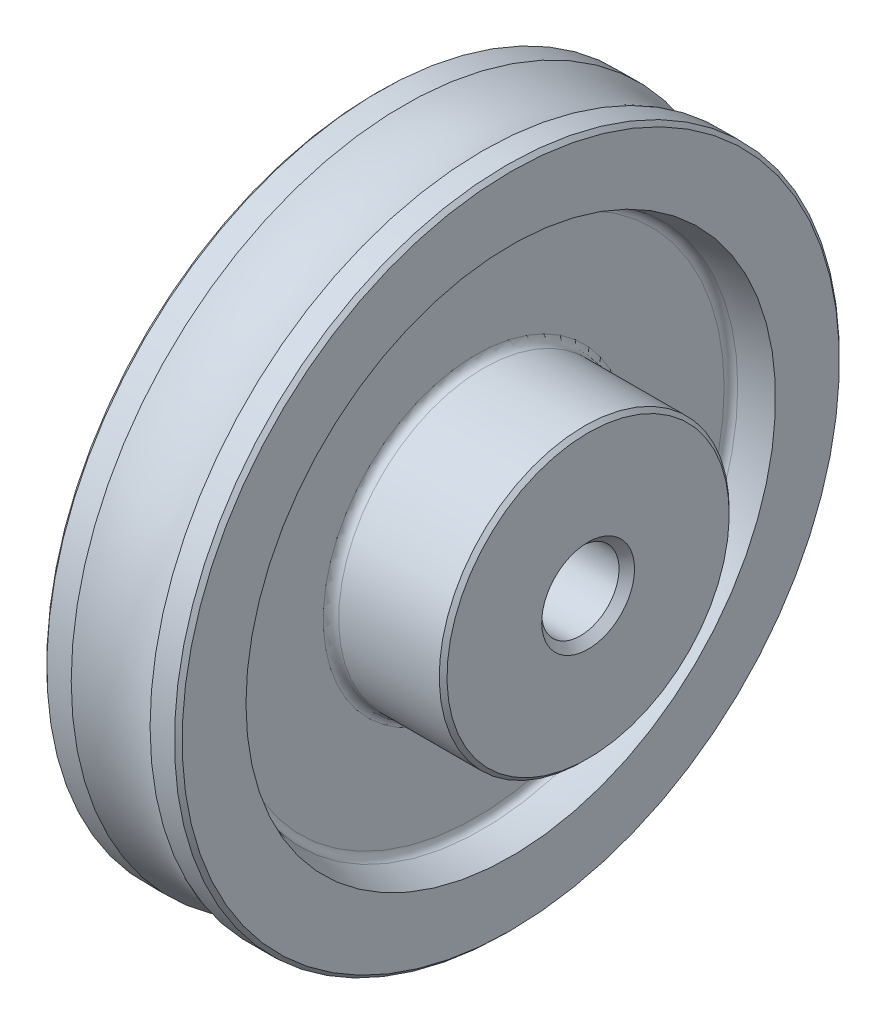
from build123d import *

# Parameters (mm, degrees)
CROQUIS2_R            = 27
CROQUIS4_R            = 10
CORTAR_EXTRUIR1_DEPTH = 134.4803358
CHAFL_N1_SIZE         = 1
CHAFL_N2_SIZE         = 2
REDONDEO3_R           = 2
REDONDEO5_R           = 2


with BuildPart() as part:
    # Croquis1 → Revolución1 (revolve)
    with BuildSketch(Plane.XY):
        Polygon((-17.5, 0), (17.5, 0), (37.5, 0), (37.5, 37.5), (17.5, 37.5), (17.5, 86), (-17.5, 86), align=None)
    revolve(axis=Axis((0, 0, 0), (-1, 0, 0)))

    # Croquis2 → Cortar-Revolución1 (revolve, cut)
    with BuildSketch(Plane.XY):
        with Locations((0, 111)):
            Circle(CROQUIS2_R)
    revolve(axis=Axis((0, 0, 0), (-1, 0, 0)), mode=Mode.SUBTRACT)

    # Croquis3 → Cortar-Revolución2 (revolve, cut)
    with BuildSketch(Plane.XY, mode=Mode.PRIVATE) as cortar_revoluci_n2_sk:
        with BuildLine():
            Line((-8.5, 37.5), (-8.5, 65.830873376))
            ThreePointArc((-8.5, 65.830873376), (-13.06832274, 66.93505996), (-17.5, 68.5))
            Line((-17.5, 68.5), (-17.5, 37.5))
            Line((-17.5, 37.5), (-8.5, 37.5))
        make_face()
        with BuildLine():
            Line((8.5, 37.5), (8.5, 65.830873376))
            ThreePointArc((8.5, 65.830873376), (13.06832274, 66.93505996), (17.5, 68.5))
            Line((17.5, 68.5), (17.5, 37.5))
            Line((17.5, 37.5), (8.5, 37.5))
        make_face()
    revolve(cortar_revoluci_n2_sk.sketch.rotate(Axis((0, 0, 0), (1, 0, 0)), 90), axis=Axis((0, 0, 0), (1, 0, 0)), mode=Mode.SUBTRACT)

    # Croquis4 → Cortar-Extruir1 (cut, through all)
    with BuildSketch(Plane(origin=(37.5, 0, 0), x_dir=(0, 0, -1), z_dir=(1, 0, 0))):
        with Locations(Location((0, 0, 0), (0, 0, 90))):
            Circle(CROQUIS4_R)
    extrude(amount=-CORTAR_EXTRUIR1_DEPTH, mode=Mode.SUBTRACT)

    # Chaflán1
    chafl_n1_edges = [part.edges().sort_by_distance(p)[0] for p in [
        (-17.5, 0, -37.5),
        (37.5, -37.5, 0),
        (17.5, -86, 0),
        (-17.5, -86, 0),
    ]]
    chamfer(chafl_n1_edges, length=CHAFL_N1_SIZE)

    # Chaflán2
    chafl_n2_edges = [part.edges().sort_by_distance(p)[0] for p in [
        (-17.5, -10, 0),
        (37.5, -10, 0),
    ]]
    chamfer(chafl_n2_edges, length=CHAFL_N2_SIZE)

    # Redondeo3
    redondeo3_edges = [part.edges().sort_by_distance(p)[0] for p in [
        (-8.5, 0, -65.830873376),
        (8.5, 0, -65.830873376),
    ]]
    fillet(redondeo3_edges, radius=REDONDEO3_R)

    # Redondeo5
    redondeo5_edges = [part.edges().sort_by_distance(p)[0] for p in [
        (-8.5, 0, -37.5),
        (8.5, 0, -37.5),
    ]]
    fillet(redondeo5_edges, radius=REDONDEO5_R)


solid = part.part
